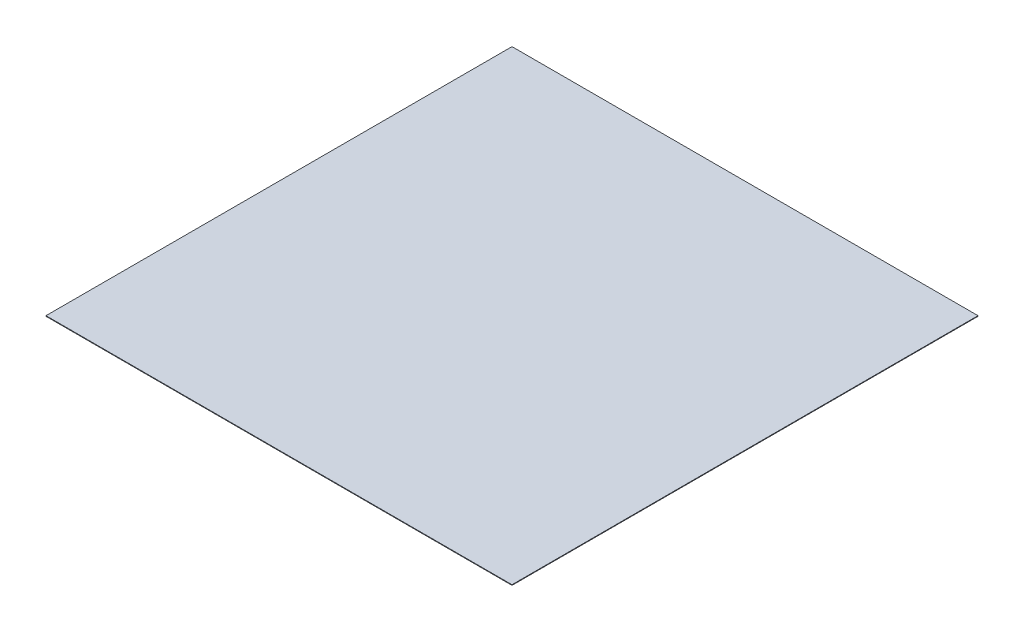
from build123d import *

# Parameters (mm, degrees)
SKETCH1_W      = 20320
SKETCH1_H      = 20320
EXTRUDE1_DEPTH = 25.4


with BuildPart() as part:
    # Sketch1 → Extrude1 (new body)
    with BuildSketch(Plane(origin=(0, 0, 0), x_dir=(1, 0, 0), z_dir=(0, 1, 0))):
        with Locations((10160, 10160)):
            Rectangle(SKETCH1_W, SKETCH1_H)
    extrude(amount=EXTRUDE1_DEPTH)


solid = part.part
